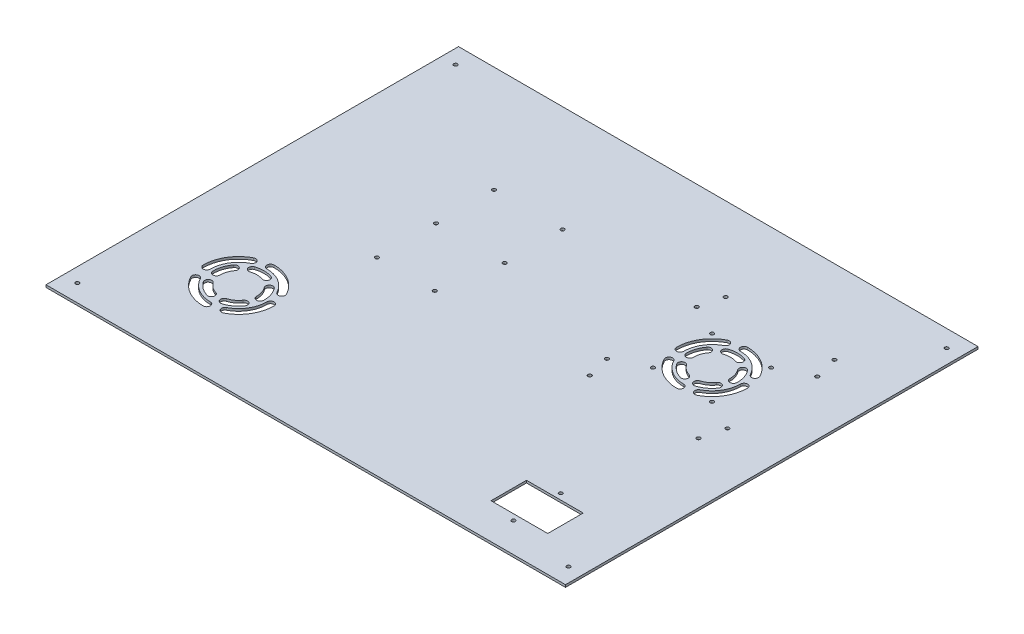
from build123d import *

# Parameters (mm, degrees)
CROQUIS1_W              = 440.5
CROQUIS1_H              = 320
SALIENTE_EXTRUIR1_DEPTH = 2
CROQUIS2_R              = 1.55
CORTAR_EXTRUIR1_DEPTH   = 2
CROQUIS3_W              = 440.5
CROQUIS3_H              = 320
CROQUIS3_W_2            = 439.5
CROQUIS3_H_2            = 319
CORTAR_EXTRUIR2_DEPTH   = 2
CROQUIS4_R              = 1.55
CORTAR_EXTRUIR3_DEPTH   = 2
CROQUIS5_R              = 1.55
CROQUIS5_W              = 48
CROQUIS5_H              = 30
CORTAR_EXTRUIR4_DEPTH   = 2
CROQUIS6_R              = 1.55
CORTAR_EXTRUIR5_DEPTH   = 2
CROQUIS7_R              = 1.55
CORTAR_EXTRUIR6_DEPTH   = 2
CROQUIS8_W              = 439.5
CROQUIS8_H              = 30
SALIENTE_EXTRUIR2_DEPTH = 2
CROQUIS9_R              = 1.55
CORTAR_EXTRUIR7_DEPTH   = 2
CROQUIS10_R             = 1.75
SALIENTE_EXTRUIR3_DEPTH = 2


with BuildPart() as part:
    # Croquis1 → Saliente-Extruir1 (new body)
    with BuildSketch(Plane(origin=(0, 0, 0), x_dir=(1, 0, 0), z_dir=(0, 1, 0))):
        with Locations((220.25, 160)):
            Rectangle(CROQUIS1_W, CROQUIS1_H)
    extrude(amount=SALIENTE_EXTRUIR1_DEPTH)

    # Croquis2 → Cortar-Extruir1 (cut)
    with BuildSketch(Plane(origin=(0, 2, 0), x_dir=(1, 0, 0), z_dir=(0, 1, 0))):
        with Locations(Location((12.5, 305, 0), (0, 0, 270))):
            Circle(CROQUIS2_R)
        with Locations(Location((428, 305, 0), (0, 0, 90))):
            Circle(CROQUIS2_R)
        with Locations(Location((428, 15, 0), (0, 0, 270))):
            Circle(CROQUIS2_R)
        with Locations(Location((12.5, 15, 0), (0, 0, 90))):
            Circle(CROQUIS2_R)
    extrude(amount=-CORTAR_EXTRUIR1_DEPTH, mode=Mode.SUBTRACT)

    # Croquis3 → Cortar-Extruir2 (cut)
    with BuildSketch(Plane(origin=(0, 2, 0), x_dir=(1, 0, 0), z_dir=(0, 1, 0))):
        with Locations((220.25, 160)):
            Rectangle(CROQUIS3_W, CROQUIS3_H)
        with Locations((220.25, 160)):
            Rectangle(CROQUIS3_W_2, CROQUIS3_H_2, mode=Mode.SUBTRACT)
    extrude(amount=-CORTAR_EXTRUIR2_DEPTH, mode=Mode.SUBTRACT)

    # Croquis4 → Cortar-Extruir3 (cut)
    with BuildSketch(Plane(origin=(0, 2, 0), x_dir=(1, 0, 0), z_dir=(0, 1, 0))):
        with Locations(Location((368, 246.5, 0), (0, 0, 270))):
            Circle(CROQUIS4_R)
        with Locations(Location((368, 196.5, 0), (0, 0, 270))):
            Circle(CROQUIS4_R)
        with Locations(Location((318, 196.5, 0), (0, 0, 270))):
            Circle(CROQUIS4_R)
        with Locations(Location((318, 246.5, 0), (0, 0, 270))):
            Circle(CROQUIS4_R)
        with Locations(Location((394, 259.5, 0), (0, 0, 270))):
            Circle(CROQUIS4_R)
        with Locations(Location((292, 259.5, 0), (0, 0, 270))):
            Circle(CROQUIS4_R)
        with Locations(Location((292, 183.5, 0), (0, 0, 270))):
            Circle(CROQUIS4_R)
        with Locations(Location((394, 183.5, 0), (0, 0, 270))):
            Circle(CROQUIS4_R)
        with Locations(Location((389, 279, 0), (0, 0, 270))):
            Circle(CROQUIS4_R)
        with Locations(Location((297, 279, 0), (0, 0, 270))):
            Circle(CROQUIS4_R)
        with Locations(Location((297, 164, 0), (0, 0, 270))):
            Circle(CROQUIS4_R)
        with Locations(Location((389, 164, 0), (0, 0, 270))):
            Circle(CROQUIS4_R)
        with BuildLine():
            ThreePointArc((109.102065733, 95.368312757), (98.055555556, 107.151991957), (82.5, 111.5))
            ThreePointArc((82.5, 111.5), (79.5, 108.5), (82.5, 105.5))
            ThreePointArc((82.5, 105.5), (94.944444444, 102.021593566), (103.781652586, 92.594650206))
            ThreePointArc((103.781652586, 92.594650206), (107.828690436, 91.321274908), (109.102065733, 95.368312757))
        make_face()
        with BuildLine():
            ThreePointArc((93.594650206, 60.218347414), (103.021593566, 69.055555556), (106.5, 81.5))
            ThreePointArc((106.5, 81.5), (109.5, 84.5), (112.5, 81.5))
            ThreePointArc((112.5, 81.5), (108.151991957, 65.944444444), (96.368312757, 54.897934267))
            ThreePointArc((96.368312757, 54.897934267), (92.321274908, 56.171309564), (93.594650206, 60.218347414))
        make_face()
        with BuildLine():
            ThreePointArc((61.218347414, 70.405349794), (70.055555556, 60.978406434), (82.5, 57.5))
            ThreePointArc((82.5, 57.5), (85.5, 54.5), (82.5, 51.5))
            ThreePointArc((82.5, 51.5), (66.944444444, 55.848008043), (55.897934267, 67.631687243))
            ThreePointArc((55.897934267, 67.631687243), (57.171309564, 71.678725092), (61.218347414, 70.405349794))
        make_face()
        with BuildLine():
            ThreePointArc((71.405349794, 102.781652586), (61.978406434, 93.944444444), (58.5, 81.5))
            ThreePointArc((58.5, 81.5), (55.5, 78.5), (52.5, 81.5))
            ThreePointArc((52.5, 81.5), (56.848008043, 97.055555556), (68.631687243, 108.102065733))
            ThreePointArc((68.631687243, 108.102065733), (72.678725092, 106.828690436), (71.405349794, 102.781652586))
        make_face()
        with BuildLine():
            ThreePointArc((89.472972973, 101.837837838), (82.5, 103), (75.527027027, 101.837837838))
            ThreePointArc((75.527027027, 101.837837838), (73.662162162, 98.027027027), (77.472972973, 96.162162162))
            ThreePointArc((77.472972973, 96.162162162), (82.5, 97), (87.527027027, 96.162162162))
            ThreePointArc((87.527027027, 96.162162162), (91.337837838, 98.027027027), (89.472972973, 101.837837838))
        make_face()
        with BuildLine():
            ThreePointArc((103.997200353, 81.153046137), (102.9477151, 88.143865379), (99.687666053, 94.416428905))
            ThreePointArc((99.687666053, 94.416428905), (95.487094664, 95.012415483), (94.891108085, 90.811844094))
            ThreePointArc((94.891108085, 90.811844094), (97.241376003, 86.289763413), (97.99798165, 81.249870471))
            ThreePointArc((97.99798165, 81.249870471), (100.949178834, 78.201848952), (103.997200353, 81.153046137))
        make_face()
        with BuildLine():
            ThreePointArc((88.813027508, 60.947732882), (95.137382924, 64.106134621), (100.095534781, 69.144954238))
            ThreePointArc((100.095534781, 69.144954238), (99.364303755, 73.324105012), (95.185152982, 72.592873986))
            ThreePointArc((95.185152982, 72.592873986), (91.610671411, 68.960236587), (87.05125239, 66.683249287))
            ThreePointArc((87.05125239, 66.683249287), (85.064381746, 62.934603525), (88.813027508, 60.947732882))
        make_face()
        with BuildLine():
            ThreePointArc((64.904465219, 69.144954238), (69.862617076, 64.106134621), (76.186972492, 60.947732882))
            ThreePointArc((76.186972492, 60.947732882), (79.935618254, 62.934603525), (77.94874761, 66.683249287))
            ThreePointArc((77.94874761, 66.683249287), (73.389328589, 68.960236587), (69.814847018, 72.592873986))
            ThreePointArc((69.814847018, 72.592873986), (65.635696245, 73.324105012), (64.904465219, 69.144954238))
        make_face()
        with BuildLine():
            ThreePointArc((65.312333947, 94.416428905), (62.0522849, 88.143865379), (61.002799647, 81.153046137))
            ThreePointArc((61.002799647, 81.153046137), (64.050821166, 78.201848952), (67.00201835, 81.249870471))
            ThreePointArc((67.00201835, 81.249870471), (67.758623997, 86.289763413), (70.108891915, 90.811844094))
            ThreePointArc((70.108891915, 90.811844094), (69.512905336, 95.012415483), (65.312333947, 94.416428905))
        make_face()
        with BuildLine():
            ThreePointArc((369.602065733, 235.368312757), (358.555555556, 247.151991957), (343, 251.5))
            ThreePointArc((343, 251.5), (340, 248.5), (343, 245.5))
            ThreePointArc((343, 245.5), (355.444444444, 242.021593566), (364.281652586, 232.594650206))
            ThreePointArc((364.281652586, 232.594650206), (368.328690436, 231.321274908), (369.602065733, 235.368312757))
        make_face()
        with BuildLine():
            ThreePointArc((356.868312757, 194.897934267), (368.651991957, 205.944444444), (373, 221.5))
            ThreePointArc((373, 221.5), (370, 224.5), (367, 221.5))
            ThreePointArc((367, 221.5), (363.521593566, 209.055555556), (354.094650206, 200.218347414))
            ThreePointArc((354.094650206, 200.218347414), (352.821274908, 196.171309564), (356.868312757, 194.897934267))
        make_face()
        with BuildLine():
            ThreePointArc((349.972972973, 241.837837838), (343, 243), (336.027027027, 241.837837838))
            ThreePointArc((336.027027027, 241.837837838), (334.162162162, 238.027027027), (337.972972973, 236.162162162))
            ThreePointArc((337.972972973, 236.162162162), (343, 237), (348.027027027, 236.162162162))
            ThreePointArc((348.027027027, 236.162162162), (351.837837838, 238.027027027), (349.972972973, 241.837837838))
        make_face()
        with BuildLine():
            ThreePointArc((316.397934267, 207.631687243), (327.444444444, 195.848008043), (343, 191.5))
            ThreePointArc((343, 191.5), (346, 194.5), (343, 197.5))
            ThreePointArc((343, 197.5), (330.555555556, 200.978406434), (321.718347414, 210.405349794))
            ThreePointArc((321.718347414, 210.405349794), (317.671309564, 211.678725092), (316.397934267, 207.631687243))
        make_face()
        with BuildLine():
            ThreePointArc((329.131687243, 248.102065733), (317.348008043, 237.055555556), (313, 221.5))
            ThreePointArc((313, 221.5), (316, 218.5), (319, 221.5))
            ThreePointArc((319, 221.5), (322.478406434, 233.944444444), (331.905349794, 242.781652586))
            ThreePointArc((331.905349794, 242.781652586), (333.178725092, 246.828690436), (329.131687243, 248.102065733))
        make_face()
        with BuildLine():
            ThreePointArc((364.497200353, 221.153046137), (363.4477151, 228.143865379), (360.187666053, 234.416428905))
            ThreePointArc((360.187666053, 234.416428905), (355.987094664, 235.012415483), (355.391108085, 230.811844094))
            ThreePointArc((355.391108085, 230.811844094), (357.741376003, 226.289763413), (358.49798165, 221.249870471))
            ThreePointArc((358.49798165, 221.249870471), (361.449178834, 218.201848952), (364.497200353, 221.153046137))
        make_face()
        with BuildLine():
            ThreePointArc((349.313027508, 200.947732882), (355.637382924, 204.106134621), (360.595534781, 209.144954238))
            ThreePointArc((360.595534781, 209.144954238), (359.864303755, 213.324105012), (355.685152982, 212.592873986))
            ThreePointArc((355.685152982, 212.592873986), (352.110671411, 208.960236587), (347.55125239, 206.683249287))
            ThreePointArc((347.55125239, 206.683249287), (345.564381746, 202.934603525), (349.313027508, 200.947732882))
        make_face()
        with BuildLine():
            ThreePointArc((325.404465219, 209.144954238), (330.362617076, 204.106134621), (336.686972492, 200.947732882))
            ThreePointArc((336.686972492, 200.947732882), (340.435618254, 202.934603525), (338.44874761, 206.683249287))
            ThreePointArc((338.44874761, 206.683249287), (333.889328589, 208.960236587), (330.314847018, 212.592873986))
            ThreePointArc((330.314847018, 212.592873986), (326.135696245, 213.324105012), (325.404465219, 209.144954238))
        make_face()
        with BuildLine():
            ThreePointArc((325.812333947, 234.416428905), (322.5522849, 228.143865379), (321.502799647, 221.153046137))
            ThreePointArc((321.502799647, 221.153046137), (324.550821166, 218.201848952), (327.50201835, 221.249870471))
            ThreePointArc((327.50201835, 221.249870471), (328.258623997, 226.289763413), (330.608891915, 230.811844094))
            ThreePointArc((330.608891915, 230.811844094), (330.012905336, 235.012415483), (325.812333947, 234.416428905))
        make_face()
    extrude(amount=-CORTAR_EXTRUIR3_DEPTH, mode=Mode.SUBTRACT)

    # Croquis5 → Cortar-Extruir4 (cut)
    with BuildSketch(Plane.XZ):
        with Locations(Location((371, -25.5, 0), (0, 0, 270))):
            Circle(CROQUIS5_R)
        with Locations(Location((371, -65.5, 0), (0, 0, 270))):
            Circle(CROQUIS5_R)
        with Locations((371, -45.5)):
            Rectangle(CROQUIS5_W, CROQUIS5_H)
    extrude(amount=-CORTAR_EXTRUIR4_DEPTH, mode=Mode.SUBTRACT)

    # Croquis6 → Cortar-Extruir5 (cut)
    with BuildSketch(Plane.XZ):
        with Locations(Location((178.5, -259.5, 0), (0, 0, 270))):
            Circle(CROQUIS6_R)
        with Locations(Location((178.5, -210.5, 0), (0, 0, 270))):
            Circle(CROQUIS6_R)
        with Locations(Location((120.5, -210.5, 0), (0, 0, 270))):
            Circle(CROQUIS6_R)
        with Locations(Location((120.5, -259.5, 0), (0, 0, 270))):
            Circle(CROQUIS6_R)
    extrude(amount=-CORTAR_EXTRUIR5_DEPTH, mode=Mode.SUBTRACT)

    # Croquis7 → Cortar-Extruir6 (cut)
    with BuildSketch(Plane.XZ):
        with Locations(Location((169.4, -160.5, 0), (0, 0, 270))):
            Circle(CROQUIS7_R)
        with Locations(Location((120.5, -160.5, 0), (0, 0, 270))):
            Circle(CROQUIS7_R)
    extrude(amount=-CORTAR_EXTRUIR6_DEPTH, mode=Mode.SUBTRACT)

    # Croquis8 → Saliente-Extruir2 (add)
    with BuildSketch(Plane.XZ):
        with Locations((220.25, -334.5)):
            Rectangle(CROQUIS8_W, CROQUIS8_H)
    extrude(amount=-SALIENTE_EXTRUIR2_DEPTH)

    # Croquis9 → Cortar-Extruir7 (cut)
    with BuildSketch(Plane.XZ):
        with Locations(Location((428, -335, 0), (0, 0, 270))):
            Circle(CROQUIS9_R)
        with Locations(Location((12.5, -335, 0), (0, 0, 270))):
            Circle(CROQUIS9_R)
    extrude(amount=-CORTAR_EXTRUIR7_DEPTH, mode=Mode.SUBTRACT)

    # Croquis10 → Saliente-Extruir3 (add)
    with BuildSketch(Plane.XZ):
        with Locations((428, -305)):
            Circle(CROQUIS10_R)
        with Locations((12.5, -305)):
            Circle(CROQUIS10_R)
    extrude(amount=-SALIENTE_EXTRUIR3_DEPTH)


solid = part.part
